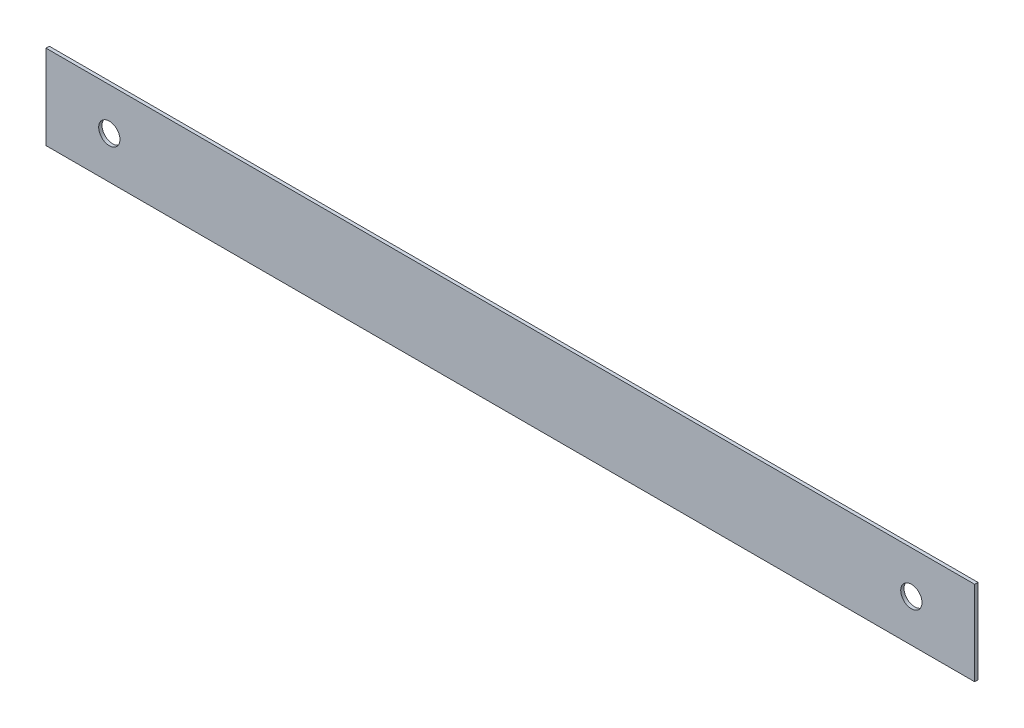
from build123d import *

# Parameters (mm, degrees)
SKETCH1_W           = 139.7
SKETCH1_H           = 12.7
SKETCH1_R           = 1.6
BOSS_EXTRUDE1_DEPTH = 0.5


with BuildPart() as part:
    # Sketch1 → Boss-Extrude1 (new body)
    with BuildSketch(Plane.XY):
        with Locations((60.325, 0)):
            Rectangle(SKETCH1_W, SKETCH1_H)
        Circle(SKETCH1_R, mode=Mode.SUBTRACT)
        with Locations((120.65, 0)):
            Circle(SKETCH1_R, mode=Mode.SUBTRACT)
    extrude(amount=BOSS_EXTRUDE1_DEPTH)


solid = part.part
